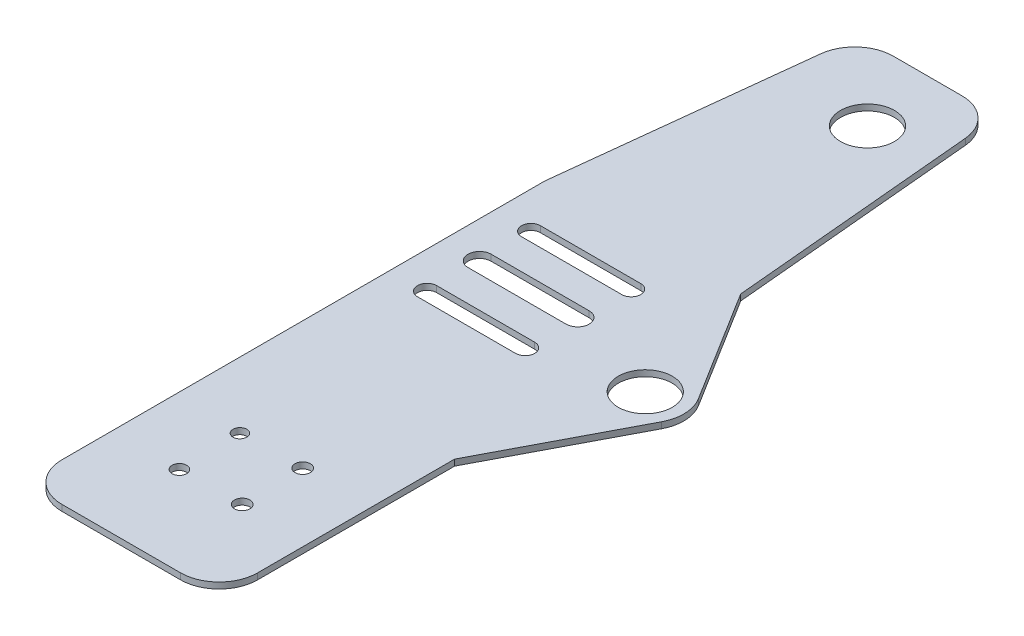
from build123d import *

# Parameters (mm, degrees)
SKETCH1_R           = 1.896979128
SKETCH1_R_2         = 1.786033574
SKETCH1_R_3         = 2
SKETCH1_R_4         = 7
BOSS_EXTRUDE1_DEPTH = 1.5875
SKETCH4_W           = 66.272407177
SKETCH4_H           = 27.800260981
CUT_EXTRUDE2_DEPTH  = 20
FILLET3_R           = 10
FILLET4_R           = 10
BOSS_EXTRUDE3_START = -1.5875
BOSS_EXTRUDE3_DEPTH = 1.5875
SKETCH7_R           = 7
CUT_EXTRUDE3_DEPTH  = 1.5875


with BuildPart() as part:
    # Sketch1 → Boss-Extrude1 (new body)
    with BuildSketch(Plane(origin=(0, 0, 0), x_dir=(1, 0, 0), z_dir=(0, 1, 0))):
        with BuildLine():
            Line((42.32729629, 228.6), (10.454309325, 228.6))
            Line((10.454309325, 228.6), (0, 135.362739137))
            Line((0, 135.362739137), (0, 0))
            Line((0, 0), (24.327009544, 0))
            Line((24.327009544, 0), (50.8, 0))
            Line((50.8, 0), (50.8, 64.87909603))
            Line((50.8, 64.87909603), (50.8, 87.423477361))
            Line((50.8, 87.423477361), (50.8, 98.200996728))
            ThreePointArc((50.8, 98.200996728), (50.4, 101.000996728), (50.8, 103.800996728))
            Line((50.8, 103.800996728), (50.8, 104.488200565))
            Line((50.8, 104.488200565), (50.8, 120.619222808))
            Line((50.8, 120.619222808), (50.8, 135.362739137))
            Line((50.8, 135.362739137), (42.32729629, 228.6))
        make_face()
        with Locations(Location((17.418441927, 23.081717093, 0), (0, 0, 270))):
            Circle(SKETCH1_R, mode=Mode.SUBTRACT)
        with Locations(Location((17.127384385, 39.079069546, 0), (0, 0, 270))):
            Circle(SKETCH1_R_2, mode=Mode.SUBTRACT)
        with Locations(Location((33.41579438, 23.372774635, 0), (0, 0, 270))):
            Circle(SKETCH1_R_3, mode=Mode.SUBTRACT)
        with Locations(Location((33.124736838, 39.370127088, 0), (0, 0, 270))):
            Circle(SKETCH1_R_3, mode=Mode.SUBTRACT)
        with BuildLine():
            Line((34.925740903, 92.78493524), (9.492033273, 92.78493524))
            ThreePointArc((9.492033273, 92.78493524), (6.992033273, 95.28493524), (9.492033273, 97.78493524))
            Line((9.492033273, 97.78493524), (34.925740903, 97.78493524))
            ThreePointArc((34.925740903, 97.78493524), (36.693507856, 97.052702193), (37.425740903, 95.28493524))
            ThreePointArc((37.425740903, 95.28493524), (36.693507856, 93.517168287), (34.925740903, 92.78493524))
        make_face(mode=Mode.SUBTRACT)
        with BuildLine():
            Line((34.925740903, 105.90993524), (9.492033273, 105.90993524))
            ThreePointArc((9.492033273, 105.90993524), (6.492033273, 108.90993524), (9.492033273, 111.90993524))
            Line((9.492033273, 111.90993524), (34.925740903, 111.90993524))
            ThreePointArc((34.925740903, 111.90993524), (37.047061246, 111.031255584), (37.925740903, 108.90993524))
            ThreePointArc((37.925740903, 108.90993524), (37.047061246, 106.788614896), (34.925740903, 105.90993524))
        make_face(mode=Mode.SUBTRACT)
        with BuildLine():
            Line((35.509675341, 119.784935244), (9.492033273, 119.784935244))
            ThreePointArc((9.492033273, 119.784935244), (7.026609419, 122.250359097), (9.492033273, 124.71578295))
            Line((9.492033273, 124.71578295), (35.509675341, 124.71578295))
            ThreePointArc((35.509675341, 124.71578295), (37.252993266, 123.993677022), (37.975099194, 122.250359097))
            ThreePointArc((37.975099194, 122.250359097), (37.252993266, 120.507041172), (35.509675341, 119.784935244))
        make_face(mode=Mode.SUBTRACT)
        with Locations(Location((29.504213454, 189.557234372, 0), (0, 0, 270))):
            Circle(SKETCH1_R_4, mode=Mode.SUBTRACT)
    extrude(amount=BOSS_EXTRUDE1_DEPTH)

    # Sketch4 → Cut-Extrude2 (cut)
    with BuildSketch(Plane(origin=(0, 0, -228.6), x_dir=(-1, 0, 0), z_dir=(0, 0, -1))):
        with Locations((-28.174690156, -1.980940155)):
            Rectangle(SKETCH4_W, SKETCH4_H)
    extrude(amount=-CUT_EXTRUDE2_DEPTH, mode=Mode.SUBTRACT)

    # Fillet3
    fillet3_edges = [part.edges().sort_by_distance(p)[0] for p in [
        (44.144746445, 0.79375, -208.6),
    ]]
    fillet(fillet3_edges, radius=FILLET3_R)

    # Fillet4
    fillet4_edges = [part.edges().sort_by_distance(p)[0] for p in [
        (50.8, 0.79375, 0),
        (0, 0.79375, 0),
        (8.211791854, 0.79375, -208.6),
    ]]
    fillet(fillet4_edges, radius=FILLET4_R)

    # Sketch6 → Boss-Extrude3 (add)
    with BuildSketch(Plane(origin=(0, 1.5875, 0), x_dir=(1, 0, 0), z_dir=(0, 1, 0)).offset(BOSS_EXTRUDE3_START)):
        with BuildLine():
            Line((50.8, 135.362739137), (50.8, 103.800996728))
            ThreePointArc((50.8, 103.800996728), (50.4, 101.000996728), (50.8, 98.200996728))
            Line((50.8, 98.200996728), (50.8, 61.124243317))
            Line((50.8, 61.124243317), (69.258211507, 96.360728536))
            ThreePointArc((69.258211507, 96.360728536), (70.393157133, 101.370875786), (68.890940865, 106.283413148))
            Line((68.890940865, 106.283413148), (50.8, 135.362739137))
        make_face()
    extrude(amount=BOSS_EXTRUDE3_DEPTH)

    # Sketch7 → Cut-Extrude3 (cut)
    with BuildSketch(Plane(origin=(0, 1.5875, 0), x_dir=(1, 0, 0), z_dir=(0, 1, 0))):
        with Locations(Location((60.4, 101.000996728, 0), (0, 0, 270))):
            Circle(SKETCH7_R)
    extrude(amount=-CUT_EXTRUDE3_DEPTH, mode=Mode.SUBTRACT)


solid = part.part
